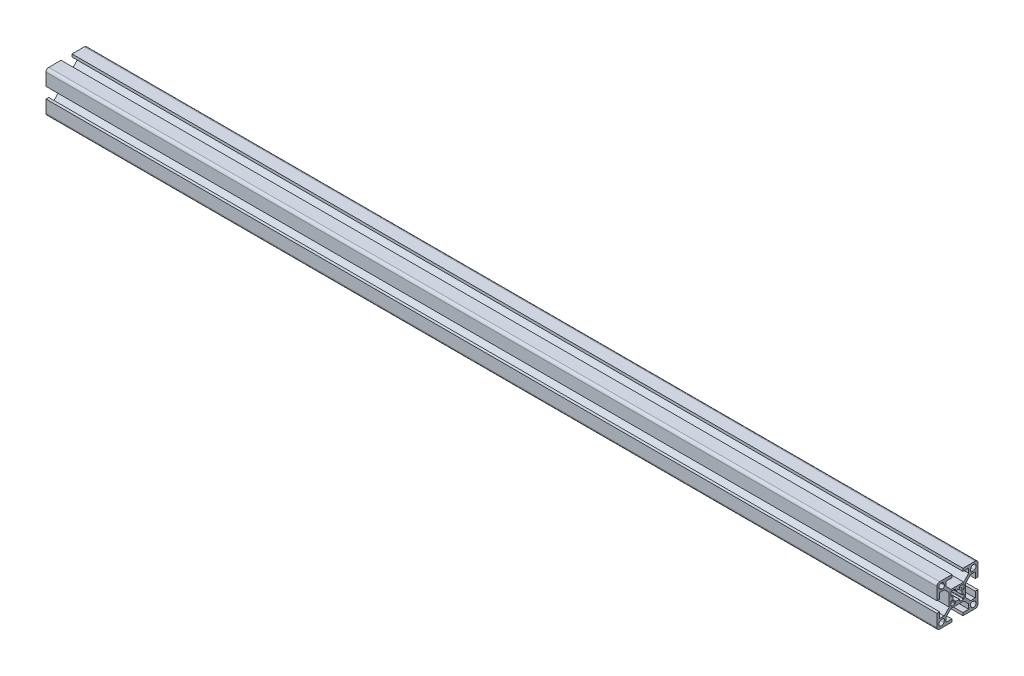
from build123d import *

# Parameters (mm, degrees)
BOSS_EXTRUDE1_DEPTH = 650


with BuildPart() as part:
    # Sketch1 → Boss-Extrude1 (new body)
    with BuildSketch(Plane(origin=(0, 0, 0), x_dir=(0, 0, -1), z_dir=(1, 0, 0))):
        with BuildLine():
            Line((-15, 13), (-15, 4))
            Line((-15, 4), (-13, 4))
            Line((-13, 4), (-13, 8.25))
            Line((-13, 8.25), (-9.664213562, 8.25))
            Line((-9.664213562, 8.25), (-6, 4.585786438))
            Line((-6, 4.585786438), (-6, -4.585786438))
            Line((-6, -4.585786438), (-9.664213562, -8.25))
            Line((-9.664213562, -8.25), (-13, -8.25))
            Line((-13, -8.25), (-13, -4))
            Line((-13, -4), (-15, -4))
            Line((-15, -4), (-15, -13))
            ThreePointArc((-15, -13), (-14.414213562, -14.414213562), (-13, -15))
            Line((-13, -15), (-4, -15))
            Line((-4, -15), (-4, -13))
            Line((-4, -13), (-8.25, -13))
            Line((-8.25, -13), (-8.25, -9.664213562))
            Line((-8.25, -9.664213562), (-4.585786438, -6))
            Line((-4.585786438, -6), (4.585786438, -6))
            Line((4.585786438, -6), (8.25, -9.664213562))
            Line((8.25, -9.664213562), (8.25, -13))
            Line((8.25, -13), (4, -13))
            Line((4, -13), (4, -15))
            Line((4, -15), (13, -15))
            ThreePointArc((13, -15), (14.414213562, -14.414213562), (15, -13))
            Line((15, -13), (15, -4))
            Line((15, -4), (13, -4))
            Line((13, -4), (13, -8.25))
            Line((13, -8.25), (9.664213562, -8.25))
            Line((9.664213562, -8.25), (6, -4.585786438))
            Line((6, -4.585786438), (6, 4.585786438))
            Line((6, 4.585786438), (9.664213562, 8.25))
            Line((9.664213562, 8.25), (13, 8.25))
            Line((13, 8.25), (13, 4))
            Line((13, 4), (15, 4))
            Line((15, 4), (15, 13))
            ThreePointArc((15, 13), (14.414213562, 14.414213562), (13, 15))
            Line((13, 15), (4, 15))
            Line((4, 15), (4, 13))
            Line((4, 13), (8.25, 13))
            Line((8.25, 13), (8.25, 9.664213562))
            Line((8.25, 9.664213562), (4.585786438, 6))
            Line((4.585786438, 6), (-4.585786438, 6))
            Line((-4.585786438, 6), (-8.25, 9.664213562))
            Line((-8.25, 9.664213562), (-8.25, 13))
            Line((-8.25, 13), (-4, 13))
            Line((-4, 13), (-4, 15))
            Line((-4, 15), (-13, 15))
            ThreePointArc((-13, 15), (-14.414213562, 14.414213562), (-15, 13))
        make_face()
        with BuildLine():
            Line((-9.539070071, 11.338915743), (-9.918883282, 12.361530981))
            ThreePointArc((-9.918883282, 12.361530981), (-13.043502884, 13.043502884), (-12.361530981, 9.918883282))
            Line((-12.361530981, 9.918883282), (-11.338915743, 9.539070071))
            ThreePointArc((-11.338915743, 9.539070071), (-9.861522369, 9.861522369), (-9.539070071, 11.338915743))
        make_face(mode=Mode.SUBTRACT)
        with BuildLine():
            Line((9.918883282, 12.361530981), (9.539070071, 11.338915743))
            ThreePointArc((9.539070071, 11.338915743), (9.861522369, 9.861522369), (11.338915743, 9.539070071))
            Line((11.338915743, 9.539070071), (12.361530981, 9.918883282))
            ThreePointArc((12.361530981, 9.918883282), (13.043502884, 13.043502884), (9.918883282, 12.361530981))
        make_face(mode=Mode.SUBTRACT)
        with BuildLine():
            Line((12.361530981, -9.918883282), (11.338915743, -9.539070071))
            ThreePointArc((11.338915743, -9.539070071), (9.861522369, -9.861522369), (9.539070071, -11.338915743))
            Line((9.539070071, -11.338915743), (9.918883282, -12.361530981))
            ThreePointArc((9.918883282, -12.361530981), (13.043502884, -13.043502884), (12.361530981, -9.918883282))
        make_face(mode=Mode.SUBTRACT)
        with BuildLine():
            Line((-11.338915743, -9.539070071), (-12.361530981, -9.918883282))
            ThreePointArc((-12.361530981, -9.918883282), (-13.043502884, -13.043502884), (-9.918883282, -12.361530981))
            Line((-9.918883282, -12.361530981), (-9.539070071, -11.338915743))
            ThreePointArc((-9.539070071, -11.338915743), (-9.861522369, -9.861522369), (-11.338915743, -9.539070071))
        make_face(mode=Mode.SUBTRACT)
        with BuildLine():
            Line((-4.8, -2.644433572), (-4.8, -4.5))
            ThreePointArc((-4.8, -4.5), (-4.712132034, -4.712132034), (-4.5, -4.8))
            Line((-4.5, -4.8), (-2.644433572, -4.8))
            ThreePointArc((-2.644433572, -4.8), (-2.615679847, -4.79861886), (-2.587190874, -4.794488155))
            Line((-2.587190874, -4.794488155), (-1.742757301, -4.630346896))
            ThreePointArc((-1.742757301, -4.630346896), (-1.568512625, -4.526682207), (-1.5, -4.335858741))
            Line((-1.5, -4.335858741), (-1.5, -3.5))
            ThreePointArc((-1.5, -3.5), (-1.374371458, -3.255879959), (-1.102702703, -3.216216216))
            ThreePointArc((-1.102702703, -3.216216216), (0, -3.4), (1.102702703, -3.216216216))
            ThreePointArc((1.102702703, -3.216216216), (1.374371458, -3.255879959), (1.5, -3.5))
            Line((1.5, -3.5), (1.5, -4.335858741))
            ThreePointArc((1.5, -4.335858741), (1.568512625, -4.526682207), (1.742757301, -4.630346896))
            Line((1.742757301, -4.630346896), (2.587190874, -4.794488155))
            ThreePointArc((2.587190874, -4.794488155), (2.615679847, -4.79861886), (2.644433572, -4.8))
            Line((2.644433572, -4.8), (4.5, -4.8))
            ThreePointArc((4.5, -4.8), (4.712132034, -4.712132034), (4.8, -4.5))
            Line((4.8, -4.5), (4.8, -2.644433572))
            ThreePointArc((4.8, -2.644433572), (4.79861886, -2.615679847), (4.794488155, -2.587190874))
            Line((4.794488155, -2.587190874), (4.630346896, -1.742757301))
            ThreePointArc((4.630346896, -1.742757301), (4.526682207, -1.568512625), (4.335858741, -1.5))
            Line((4.335858741, -1.5), (3.5, -1.5))
            ThreePointArc((3.5, -1.5), (3.255879959, -1.374371458), (3.216216216, -1.102702703))
            ThreePointArc((3.216216216, -1.102702703), (3.4, 0), (3.216216216, 1.102702703))
            ThreePointArc((3.216216216, 1.102702703), (3.255879959, 1.374371458), (3.5, 1.5))
            Line((3.5, 1.5), (4.335858741, 1.5))
            ThreePointArc((4.335858741, 1.5), (4.526682207, 1.568512625), (4.630346896, 1.742757301))
            Line((4.630346896, 1.742757301), (4.794488155, 2.587190874))
            ThreePointArc((4.794488155, 2.587190874), (4.79861886, 2.615679847), (4.8, 2.644433572))
            Line((4.8, 2.644433572), (4.8, 4.5))
            ThreePointArc((4.8, 4.5), (4.712132034, 4.712132034), (4.5, 4.8))
            Line((4.5, 4.8), (2.644433572, 4.8))
            ThreePointArc((2.644433572, 4.8), (2.615679847, 4.79861886), (2.587190874, 4.794488155))
            Line((2.587190874, 4.794488155), (1.742757301, 4.630346896))
            ThreePointArc((1.742757301, 4.630346896), (1.568512625, 4.526682207), (1.5, 4.335858741))
            Line((1.5, 4.335858741), (1.5, 3.5))
            ThreePointArc((1.5, 3.5), (1.374371458, 3.255879959), (1.102702703, 3.216216216))
            ThreePointArc((1.102702703, 3.216216216), (0, 3.4), (-1.102702703, 3.216216216))
            ThreePointArc((-1.102702703, 3.216216216), (-1.374371458, 3.255879959), (-1.5, 3.5))
            Line((-1.5, 3.5), (-1.5, 4.335858741))
            ThreePointArc((-1.5, 4.335858741), (-1.568512625, 4.526682207), (-1.742757301, 4.630346896))
            Line((-1.742757301, 4.630346896), (-2.587190874, 4.794488155))
            ThreePointArc((-2.587190874, 4.794488155), (-2.615679847, 4.79861886), (-2.644433572, 4.8))
            Line((-2.644433572, 4.8), (-4.5, 4.8))
            ThreePointArc((-4.5, 4.8), (-4.712132034, 4.712132034), (-4.8, 4.5))
            Line((-4.8, 4.5), (-4.8, 2.644433572))
            ThreePointArc((-4.8, 2.644433572), (-4.79861886, 2.615679847), (-4.794488155, 2.587190874))
            Line((-4.794488155, 2.587190874), (-4.630346896, 1.742757301))
            ThreePointArc((-4.630346896, 1.742757301), (-4.526682207, 1.568512625), (-4.335858741, 1.5))
            Line((-4.335858741, 1.5), (-3.5, 1.5))
            ThreePointArc((-3.5, 1.5), (-3.255879959, 1.374371458), (-3.216216216, 1.102702703))
            ThreePointArc((-3.216216216, 1.102702703), (-3.4, 0), (-3.216216216, -1.102702703))
            ThreePointArc((-3.216216216, -1.102702703), (-3.255879959, -1.374371458), (-3.5, -1.5))
            Line((-3.5, -1.5), (-4.335858741, -1.5))
            ThreePointArc((-4.335858741, -1.5), (-4.526682207, -1.568512625), (-4.630346896, -1.742757301))
            Line((-4.630346896, -1.742757301), (-4.794488155, -2.587190874))
            ThreePointArc((-4.794488155, -2.587190874), (-4.79861886, -2.615679847), (-4.8, -2.644433572))
        make_face(mode=Mode.SUBTRACT)
    extrude(amount=BOSS_EXTRUDE1_DEPTH)


solid = part.part
